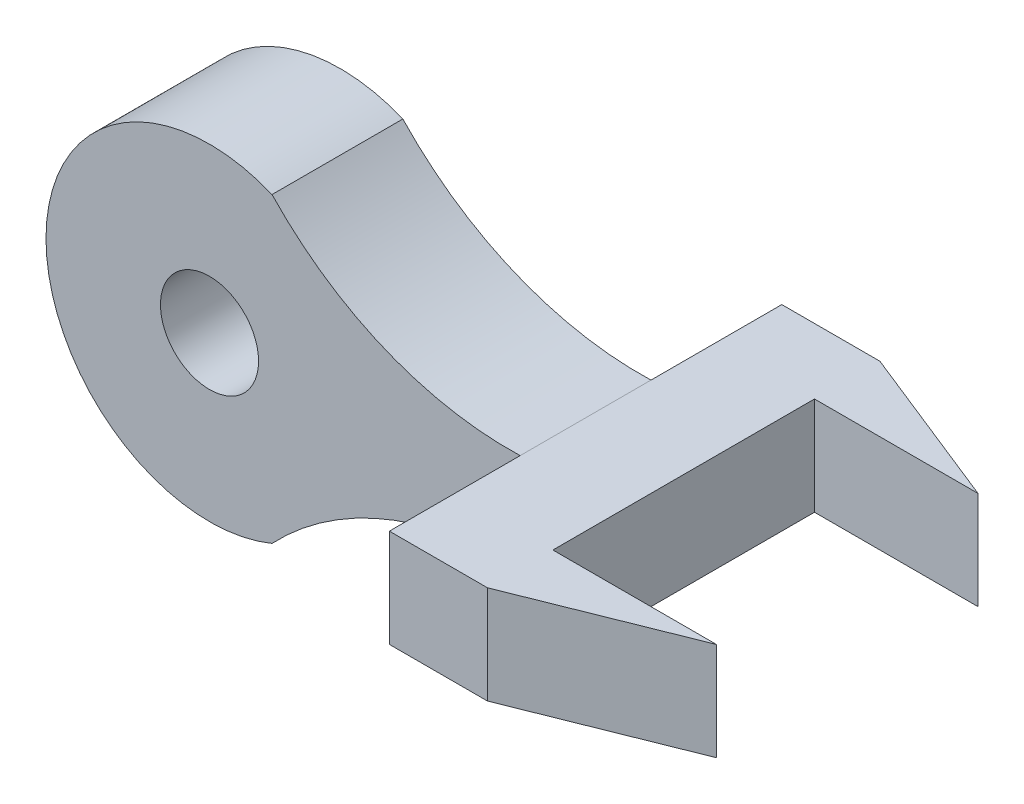
from build123d import *

# Parameters (mm, degrees)
SKETCH1_R           = 15
BOSS_EXTRUDE1_DEPTH = 20
SKETCH5_W           = 30
SKETCH5_H           = 30
BOSS_EXTRUDE2_DEPTH = 60
BOSS_EXTRUDE3_DEPTH = 30


with BuildPart() as part:
    # Sketch1 → Boss-Extrude1 (new, symmetric)
    with BuildSketch(Plane.XY):
        with BuildLine():
            Line((95, 15), (125, 15))
            Line((125, 15), (125, -15))
            Line((125, -15), (94.520902358, -15))
            ThreePointArc((94.520902358, -15), (53.491668614, -22.559030862), (19.11731281, -46.200956169))
            ThreePointArc((19.11731281, -46.200956169), (-50, 0), (19.11731281, 46.200956169))
            ThreePointArc((19.11731281, 46.200956169), (53.711420625, 22.459790206), (95, 15))
        make_face()
        Circle(SKETCH1_R, mode=Mode.SUBTRACT)
    extrude(amount=BOSS_EXTRUDE1_DEPTH, both=True)

    # Sketch5 → Boss-Extrude2 (add, symmetric)
    with BuildSketch(Plane.XY):
        with Locations((110, 0)):
            Rectangle(SKETCH5_W, SKETCH5_H)
    extrude(amount=BOSS_EXTRUDE2_DEPTH, both=True)

    # Sketch6 → Boss-Extrude3 (add)
    with BuildSketch(Plane(origin=(0, 15, 0), x_dir=(1, 0, 0), z_dir=(0, 1, 0))):
        Polygon((125, 60), (175, 40), (125, 40), align=None)
        Polygon((125, -60), (175, -40), (125, -40), align=None)
    extrude(amount=-BOSS_EXTRUDE3_DEPTH)


solid = part.part
